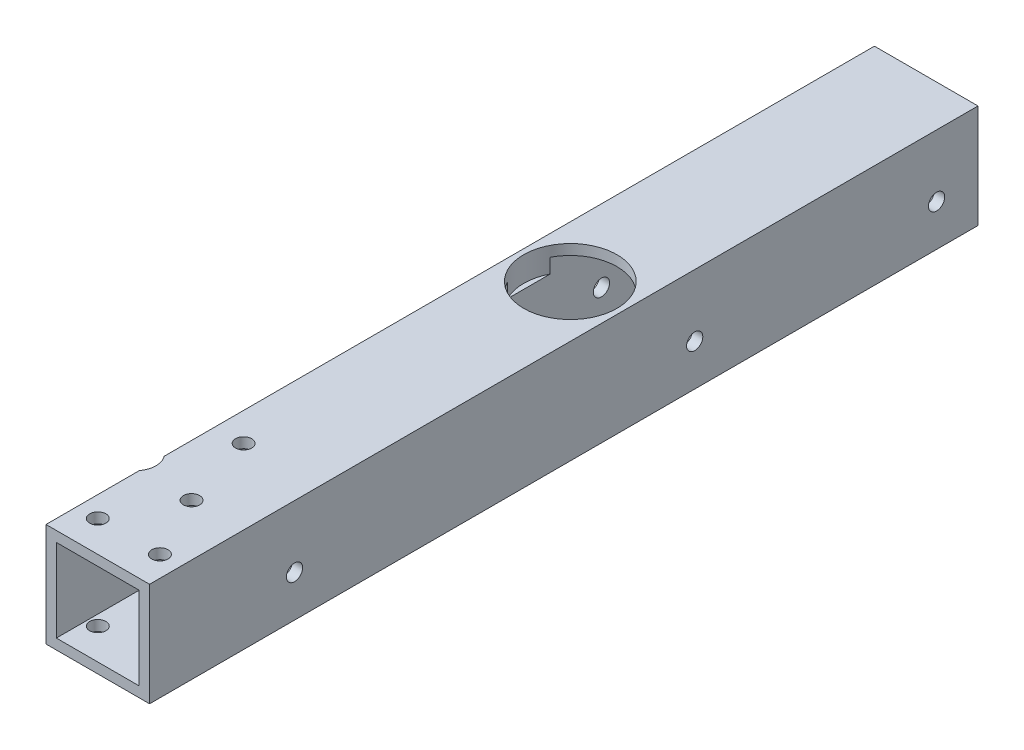
from build123d import *

# Parameters (mm, degrees)
BOSS_EXTRUDE1_DEPTH           = 127
BOSS_EXTRUDE1_DEPTH_BACK      = 127
SKETCH3_W                     = 31.75
SKETCH3_H                     = 31.75
SKETCH3_W_2                   = 25.4
SKETCH3_H_2                   = 25.4
F_10_CLEARANCE_HOLE1_D        = 4.9784
SKETCH7_R                     = 14.2875
CUT_EXTRUDE1_DEPTH            = 7.62
CUT_EXTRUDE2_START            = -7.62
SKETCH8_R                     = 14.2875
CUT_EXTRUDE2_DEPTH            = 7.62
F_10_CLEARANCE_HOLE2_D        = 4.9784
SKETCH12_R                    = 6.35
CUT_EXTRUDE3_DEPTH            = 132.867653824
TAP_DRILL_FOR_8_32_TAP1_D     = 3.4544
TAP_DRILL_FOR_8_32_TAP1_DEPTH = 5.08
TAP_DRILL_FOR_8_32_TAP1_TIP   = 1.037806461


with BuildPart() as part:
    # Sketch3 → Boss-Extrude1 (new, two sides: drawn at the far end of the back side and taken through both)
    with BuildSketch(Plane.XY.offset(-BOSS_EXTRUDE1_DEPTH_BACK)):
        Rectangle(SKETCH3_W, SKETCH3_H)
        Rectangle(SKETCH3_W_2, SKETCH3_H_2, mode=Mode.SUBTRACT)
    extrude(amount=BOSS_EXTRUDE1_DEPTH + BOSS_EXTRUDE1_DEPTH_BACK)

    # #10 Clearance Hole1 (through all)
    with Locations(Plane(origin=(0, 15.875, 0), x_dir=(1, 0, 0), z_dir=(0, 1, 0))):
        with Locations((-9.525, -117.475), (9.525, -117.475), (0, -98.247200001), (-7.111939052, -75.171256705)):
            Hole(F_10_CLEARANCE_HOLE1_D / 2)

    # Sketch7 → Cut-Extrude1 (cut)
    with BuildSketch(Plane(origin=(0, 15.875, 0), x_dir=(1, 0, 0), z_dir=(0, 1, 0))):
        with Locations(Location((0, 17.8816, 0), (0, 0, 270))):
            Circle(SKETCH7_R)
    extrude(amount=-CUT_EXTRUDE1_DEPTH, mode=Mode.SUBTRACT)

    # Sketch8 → Cut-Extrude2 (cut)
    with BuildSketch(Plane.XZ.offset(15.875).offset(CUT_EXTRUDE2_START)):
        with Locations(Location((0, -17.8816, 0), (0, 0, 90))):
            Circle(SKETCH8_R)
    extrude(amount=CUT_EXTRUDE2_DEPTH, mode=Mode.SUBTRACT)

    # #10 Clearance Hole2 (through all)
    with Locations(Plane(origin=(15.875, 0, 0), x_dir=(0, 0, -1), z_dir=(1, 0, 0))):
        with Locations((-82.55, -3.175), (114.3, -3.175), (40.132, -3.175)):
            Hole(F_10_CLEARANCE_HOLE2_D / 2)

    # Sketch12 → Cut-Extrude3 (cut, through all)
    with BuildSketch(Plane(origin=(0, 15.875, 0), x_dir=(1, 0, 0), z_dir=(0, 1, 0))):
        with Locations((-20.955, -94.557636183)):
            Circle(SKETCH12_R)
    extrude(amount=-CUT_EXTRUDE3_DEPTH, mode=Mode.SUBTRACT)

    # Tap Drill for #8-32 Tap1
    with Locations(Plane(origin=(0, -15.875, 0), x_dir=(-1, 0, 0), z_dir=(0, -1, 0))):
        with Locations((0, 35.9156), (0, -0.1524)):
            Hole(TAP_DRILL_FOR_8_32_TAP1_D / 2, depth=TAP_DRILL_FOR_8_32_TAP1_DEPTH)
            with Locations((0, 0, -(TAP_DRILL_FOR_8_32_TAP1_DEPTH + TAP_DRILL_FOR_8_32_TAP1_TIP / 2))):  # 118° drill point
                Cone(0, TAP_DRILL_FOR_8_32_TAP1_D / 2, TAP_DRILL_FOR_8_32_TAP1_TIP, mode=Mode.SUBTRACT)


solid = part.part
